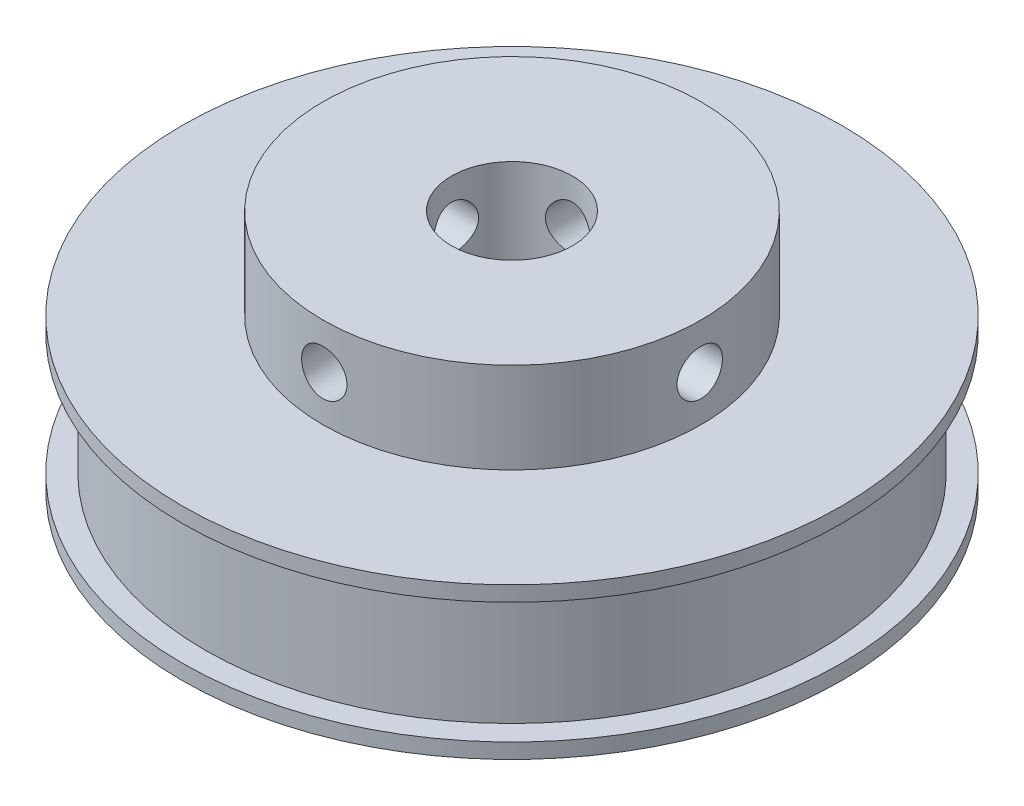
from build123d import *

# Parameters (mm, degrees)
SKETCH_2_R               = 21.8
EXTRUDE_1_DEPTH          = 16
SKETCH_3_R               = 4
CUT_EXTRUDE_1_DEPTH      = 35.734420968
SKETCH_4_OUTSIDE_W       = 58.34
SKETCH_4_OUTSIDE_H       = 58.34
SKETCH_4_OUTSIDE_R       = 12.5
CUT_EXTRUDE_2_DEPTH      = 6
SKETCH_5_OUTSIDE_W       = 58.34
SKETCH_5_OUTSIDE_H       = 58.34
SKETCH_5_OUTSIDE_R       = 20.3
CUT_EXTRUDE_3_DEPTH      = 8
CUT_EXTRUDE_4_DEPTH      = 35.734420968
CUT_EXTRUDE_4_DEPTH_BACK = 35.734420968
SKETCH_6_R               = 1.5
CUT_EXTRUDE_5_DEPTH      = 35.734421014
CUT_EXTRUDE_5_DEPTH_BACK = 35.734421014
SKETCH_7_R               = 1.5


with BuildPart() as part:
    # 草图2 → 凸台-拉伸1 (new body)
    with BuildSketch(Plane(origin=(0, 0, 0), x_dir=(1, 0, 0), z_dir=(0, 1, 0))):
        with Locations(Location((0, 0, 0), (0, 0, 270))):
            Circle(SKETCH_2_R)
    extrude(amount=EXTRUDE_1_DEPTH)

    # 草图3 → 切除-拉伸1 (cut, through all)
    with BuildSketch(Plane(origin=(0, 16, 0), x_dir=(1, 0, 0), z_dir=(0, 1, 0))):
        with Locations(Location((0, 0, 0), (0, 0, 270))):
            Circle(SKETCH_3_R)
    extrude(amount=-CUT_EXTRUDE_1_DEPTH, mode=Mode.SUBTRACT)

    # 草图4 outside → 切除-拉伸2 (cut)
    with BuildSketch(Plane(origin=(0, 16, 0), x_dir=(1, 0, 0), z_dir=(0, 1, 0))):
        Rectangle(SKETCH_4_OUTSIDE_W, SKETCH_4_OUTSIDE_H)
        with Locations(Location((0, 0, 0), (0, 0, 270))):
            Circle(SKETCH_4_OUTSIDE_R, mode=Mode.SUBTRACT)
    extrude(amount=-CUT_EXTRUDE_2_DEPTH, mode=Mode.SUBTRACT)

    # 草图5 outside → 切除-拉伸3 (cut)
    with BuildSketch(Plane(origin=(0, 1, 0), x_dir=(1, 0, 0), z_dir=(0, 1, 0))):
        Rectangle(SKETCH_5_OUTSIDE_W, SKETCH_5_OUTSIDE_H)
        with Locations(Location((0, 0, 0), (0, 0, 270))):
            Circle(SKETCH_5_OUTSIDE_R, mode=Mode.SUBTRACT)
    extrude(amount=CUT_EXTRUDE_3_DEPTH, mode=Mode.SUBTRACT)

    # 草图6 → 切除-拉伸4 (cut, two sides: drawn at the far end of the back side and taken through both)
    with BuildSketch(Plane(origin=(0, 0, 0), x_dir=(0, 0, -1), z_dir=(1, 0, 0)).offset(-CUT_EXTRUDE_4_DEPTH_BACK)):
        with Locations((0, 13)):
            Circle(SKETCH_6_R)
    extrude(amount=CUT_EXTRUDE_4_DEPTH + CUT_EXTRUDE_4_DEPTH_BACK, mode=Mode.SUBTRACT)

    # 草图7 → 切除-拉伸5 (cut, two sides: drawn at the far end of the back side and taken through both)
    with BuildSketch(Plane.XY.offset(-CUT_EXTRUDE_5_DEPTH_BACK)):
        with Locations((0, 13)):
            Circle(SKETCH_7_R)
    extrude(amount=CUT_EXTRUDE_5_DEPTH + CUT_EXTRUDE_5_DEPTH_BACK, mode=Mode.SUBTRACT)


solid = part.part
